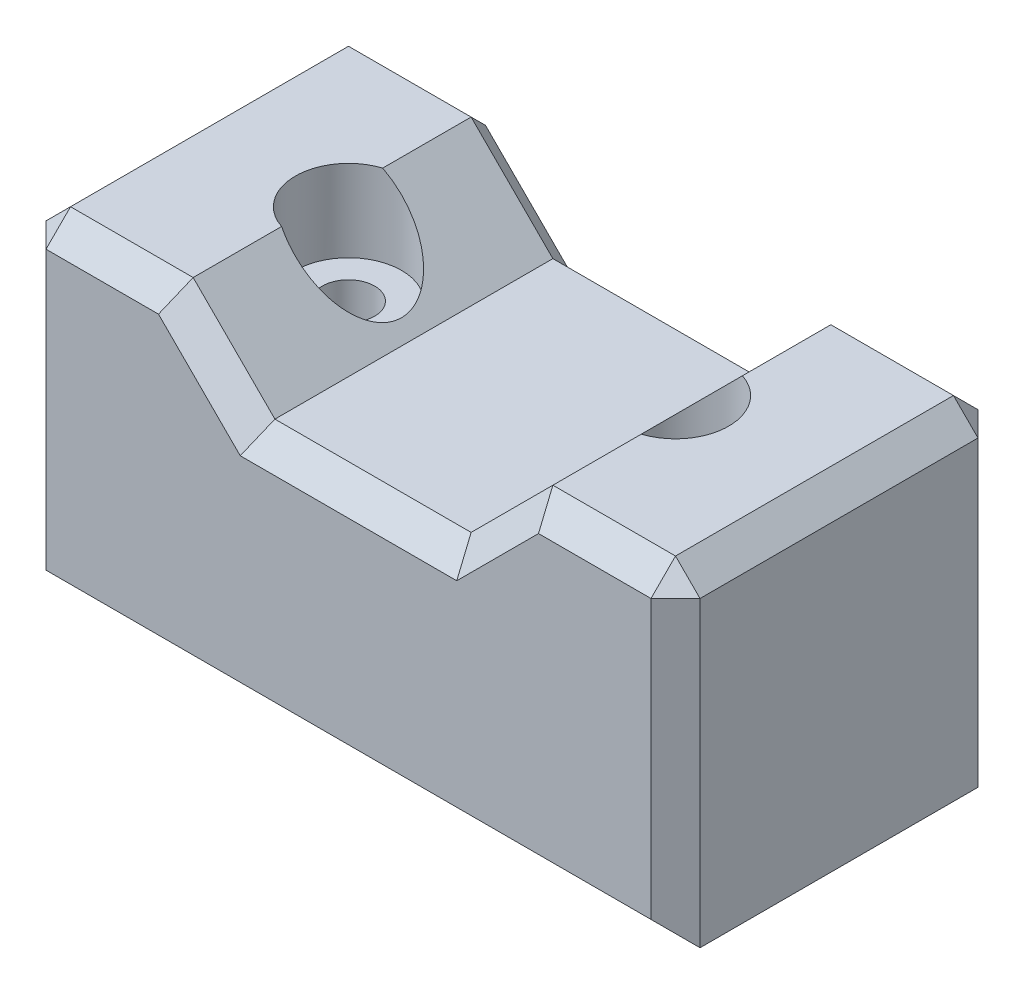
from build123d import *

# Parameters (mm, degrees)
SKETCH_1_W          = 40
SKETCH_1_H          = 20
SKETCH_1_R          = 1.6
EXTRUDE_1_DEPTH     = 20
CUT_EXTRUDE_1_DEPTH = 20
SKETCH_3_R          = 3.25
CUT_EXTRUDE_2_DEPTH = 5
CHAMFER_1_SIZE      = 1.5


with BuildPart() as part:
    # 草图1 → 凸台-拉伸1 (new body)
    with BuildSketch(Plane(origin=(0, 0, 0), x_dir=(1, 0, 0), z_dir=(0, 1, 0))):
        Rectangle(SKETCH_1_W, SKETCH_1_H)
        with Locations(Location((10, 0, 0), (0, 0, 270))):
            Circle(SKETCH_1_R, mode=Mode.SUBTRACT)
        with Locations(Location((-10, 0, 0), (0, 0, 90))):
            Circle(SKETCH_1_R, mode=Mode.SUBTRACT)
    extrude(amount=EXTRUDE_1_DEPTH)

    # 草图2 → 切除-拉伸1 (cut)
    with BuildSketch(Plane.XY.offset(10)):
        Polygon((-6, 15), (6, 15), (11, 20), (-11, 20), align=None)
    extrude(amount=-CUT_EXTRUDE_1_DEPTH, mode=Mode.SUBTRACT)

    # 草图3 → 切除-拉伸2 (cut)
    with BuildSketch(Plane(origin=(0, 20, 0), x_dir=(1, 0, 0), z_dir=(0, 1, 0))):
        with Locations(Location((10, 0, 0), (0, 0, 287.920213139))):
            Circle(SKETCH_3_R)
        with Locations(Location((-10, 0, 0), (0, 0, 252.079786861))):
            Circle(SKETCH_3_R)
    extrude(amount=-CUT_EXTRUDE_2_DEPTH, mode=Mode.SUBTRACT)

    # 倒角1
    chamfer_1_edges = [part.edges().sort_by_distance(p)[0] for p in [
        (-20, 20, 0),
        (-15.5, 20, 10),
        (15.5, 20, 10),
        (-15.5, 20, -10),
        (-8.5, 17.5, -10),
        (8.5, 17.5, -10),
        (0, 15, -10),
        (-8.5, 17.5, 10),
        (0, 15, 10),
        (8.5, 17.5, 10),
        (20, 20, 0),
        (0, 0, 10),
        (0, 0, -10),
        (20, 10, 10),
        (-20, 10, 10),
        (-20, 10, -10),
        (20, 10, -10),
        (15.5, 20, -10),
    ]]
    chamfer(chamfer_1_edges, length=CHAMFER_1_SIZE)


solid = part.part
